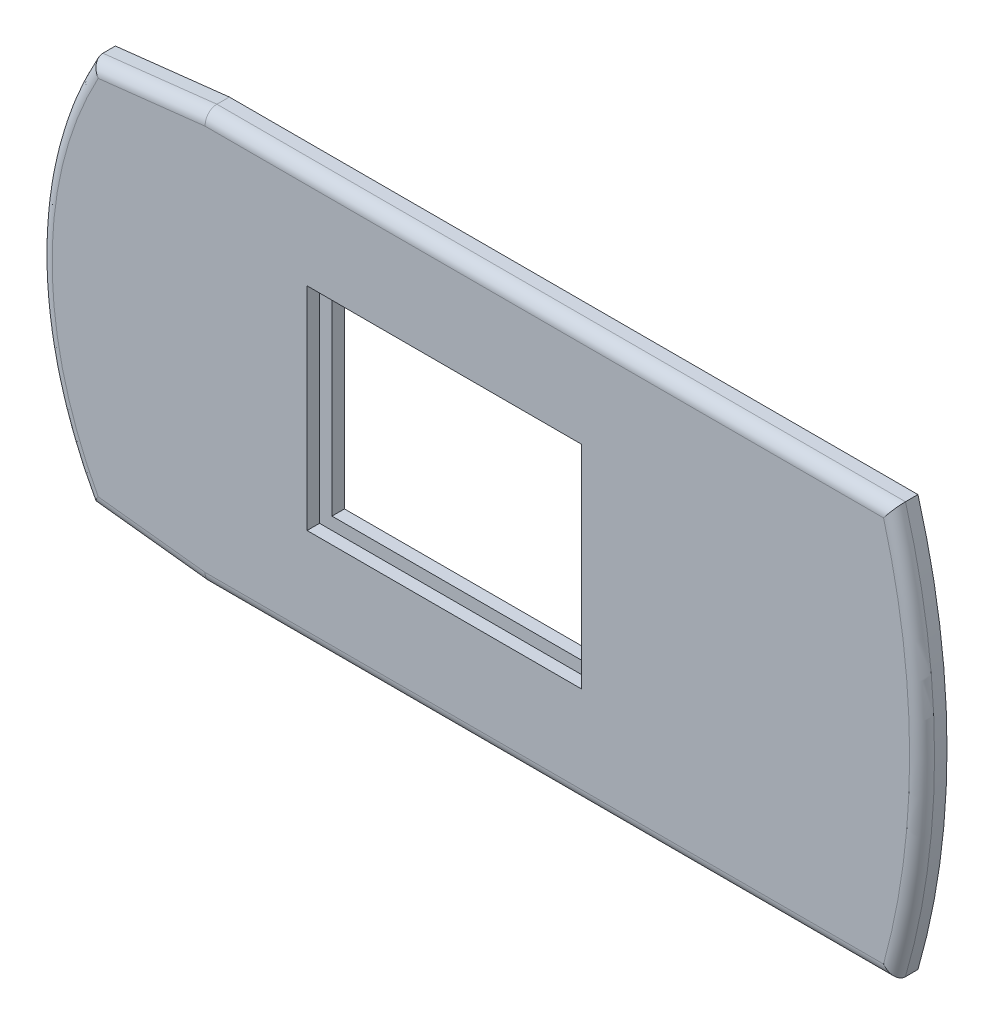
from build123d import *

# Parameters (mm, degrees)
EXTRU_MINCE1_DEPTH      = 10
ESQUISSE1_25_W          = 110
ESQUISSE1_25_H          = 85
BOSS_EXTRU_3_DEPTH      = 10
ESQUISSE1_26_R          = 2.5
ENL_V_MAT_EXTRU_1_DEPTH = 5
ESQUISSE1_27_R          = 2.5
ENL_V_MAT_EXTRU_2_DEPTH = 5
ESQUISSE1_28_R          = 2.5
ENL_V_MAT_EXTRU_3_DEPTH = 5
ESQUISSE1_29_R          = 2.5
ENL_V_MAT_EXTRU_4_DEPTH = 5
CONG_5_R                = 5
BOSS_EXTRU_4_DEPTH      = 5


with BuildPart() as part:
    # Esquisse1 → Extru.-Mince1 (new body)
    with BuildSketch(Plane.XY):
        with BuildLine():
            Line((-199.071776485, 47.699787448), (-153.336718001, 52.844981528))
            Line((-153.336718001, 52.844981528), (122.846559315, 52.844981528))
            ThreePointArc((122.846559315, 52.844981528), (134.520037722, -29.655018472), (122.846559315, -112.155018472))
            Line((122.846559315, -112.155018472), (-153.336718001, -112.155018472))
            Line((-153.336718001, -112.155018472), (-199.071776485, -107.009824393))
            ThreePointArc((-199.071776485, -107.009824393), (-219.440219924, -29.655018472), (-199.071776485, 47.699787448))
        make_face()
        with BuildLine():
            Line((-192.775986612, 38.344981528), (-152.775986612, 42.844981528))
            Line((-152.775986612, 42.844981528), (115.224013388, 42.844981528))
            ThreePointArc((115.224013388, 42.844981528), (124.520037722, -29.655018472), (115.224013388, -102.155018472))
            Line((115.224013388, -102.155018472), (-152.775986612, -102.155018472))
            Line((-152.775986612, -102.155018472), (-192.775986612, -97.655018472))
            ThreePointArc((-192.775986612, -97.655018472), (-209.440219924, -29.655018472), (-192.775986612, 38.344981528))
        make_face(mode=Mode.SUBTRACT)
    extrude(amount=EXTRU_MINCE1_DEPTH)

    # Esquisse1<25> → Boss.-Extru.3 (add)
    with BuildSketch(Plane.XY):
        with BuildLine():
            Line((-152.775986612, 42.844981528), (-192.775986612, 38.344981528))
            ThreePointArc((-192.775986612, 38.344981528), (-209.440219924, -29.655018472), (-192.775986612, -97.655018472))
            Line((-192.775986612, -97.655018472), (-152.775986612, -102.155018472))
            Line((-152.775986612, -102.155018472), (115.224013388, -102.155018472))
            ThreePointArc((115.224013388, -102.155018472), (124.520037722, -29.655018472), (115.224013388, 42.844981528))
            Line((115.224013388, 42.844981528), (-152.775986612, 42.844981528))
        make_face()
        with Locations((-57.169243918, -29.655018472)):
            Rectangle(ESQUISSE1_25_W, ESQUISSE1_25_H, mode=Mode.SUBTRACT)
    extrude(amount=BOSS_EXTRU_3_DEPTH)

    # Esquisse1<26> → Enlèv. mat.-Extru.1 (cut)
    with BuildSketch(Plane.XY):
        with Locations((130.224013388, -32.155018472)):
            Circle(ESQUISSE1_26_R)
    extrude(amount=ENL_V_MAT_EXTRU_1_DEPTH, mode=Mode.SUBTRACT)

    # Esquisse1<27> → Enlèv. mat.-Extru.2 (cut)
    with BuildSketch(Plane.XY):
        with Locations((-33.549027095, -107.155018472)):
            Circle(ESQUISSE1_27_R)
    extrude(amount=ENL_V_MAT_EXTRU_2_DEPTH, mode=Mode.SUBTRACT)

    # Esquisse1<28> → Enlèv. mat.-Extru.3 (cut)
    with BuildSketch(Plane.XY):
        with Locations((-33.549027095, 47.844981528)):
            Circle(ESQUISSE1_28_R)
    extrude(amount=ENL_V_MAT_EXTRU_3_DEPTH, mode=Mode.SUBTRACT)

    # Esquisse1<29> → Enlèv. mat.-Extru.4 (cut)
    with BuildSketch(Plane.XY):
        with Locations((-215.775986612, -32.155018472)):
            Circle(ESQUISSE1_29_R)
    extrude(amount=ENL_V_MAT_EXTRU_4_DEPTH, mode=Mode.SUBTRACT)

    # Congé5
    cong_5_edges = [part.edges().sort_by_distance(p)[0] for p in [
        (-219.440219924, -29.655018472, 10),
        (-176.204247243, 50.272384488, 10),
        (-15.245079343, 52.844981528, 10),
        (134.520037722, -29.655018472, 10),
        (-15.245079343, -112.155018472, 10),
        (-176.204247243, -109.582421433, 10),
    ]]
    fillet(cong_5_edges, radius=CONG_5_R)

    # Esquisse1<30> → Boss.-Extru.4 (add)
    with BuildSketch(Plane.XY):
        Polygon((-7.169243918, -67.155018472), (-107.169243918, -67.155018472), (-107.169243918, 12.844981528), (-112.169243918, 12.844981528), (-112.169243918, -72.155018472), (-2.169243918, -72.155018472), (-2.169243918, 12.844981528), (-7.169243918, 12.844981528), align=None)
    extrude(amount=BOSS_EXTRU_4_DEPTH)


solid = part.part
